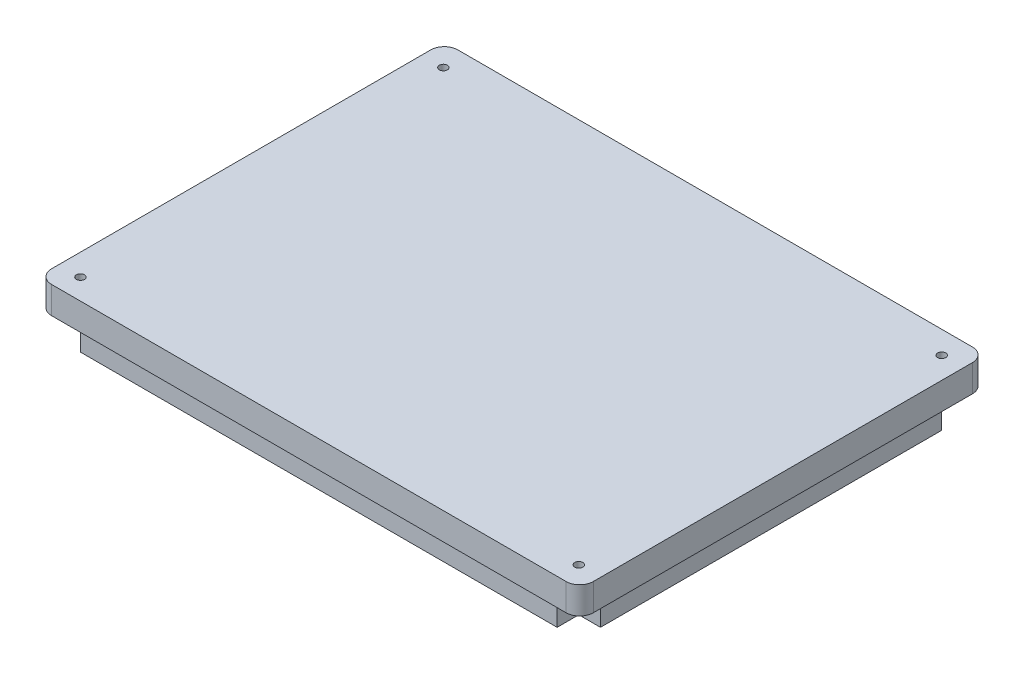
from build123d import *

# Parameters (mm, degrees)
DODANIE_WYCI_GNI_CIE1_DEPTH = 10
DODANIE_WYCI_GNI_CIE2_DEPTH = 10
SZKIC5_R                    = 1.5
WYTNIJ_WYCI_GNI_CIE1_DEPTH  = 15


with BuildPart() as part:
    # Szkic1 → Dodanie-wyciągnięcie1 (new body)
    with BuildSketch(Plane(origin=(0, 0, 0), x_dir=(1, 0, 0), z_dir=(0, 1, 0))):
        with BuildLine():
            Line((-94.981523654, 75.273037309), (95.018476346, 75.273037309))
            ThreePointArc((95.018476346, 75.273037309), (98.554010252, 73.808571215), (100.018476346, 70.273037309))
            Line((100.018476346, 70.273037309), (100.018476346, -69.726962691))
            ThreePointArc((100.018476346, -69.726962691), (98.554010252, -73.262496597), (95.018476346, -74.726962691))
            Line((95.018476346, -74.726962691), (-94.981523654, -74.726962691))
            ThreePointArc((-94.981523654, -74.726962691), (-98.51705756, -73.262496597), (-99.981523654, -69.726962691))
            Line((-99.981523654, -69.726962691), (-99.981523654, 70.273037309))
            ThreePointArc((-99.981523654, 70.273037309), (-98.51705756, 73.808571215), (-94.981523654, 75.273037309))
        make_face()
    extrude(amount=DODANIE_WYCI_GNI_CIE1_DEPTH)

    # Szkic4 → Dodanie-wyciągnięcie2 (add)
    with BuildSketch(Plane.XZ):
        Polygon((-96, 63.04375976), (-88, 63.04375976), (-88, 71.04375976), (88, 71.04375976), (88, 63.04375976), (96, 63.04375976), (96, -62.95624024), (88, -62.95624024), (88, -70.95624024), (-88, -70.95624024), (-88, -62.95624024), (-96, -62.95624024), align=None)
    extrude(amount=DODANIE_WYCI_GNI_CIE2_DEPTH)

    # Szkic5 → Wytnij-wyciągnięcie1 (cut)
    with BuildSketch(Plane.XZ):
        with Locations(Location((-92, -66.95624024, 0), (0, 0, 270))):
            Circle(SZKIC5_R)
        with Locations(Location((-92, 67.04375976, 0), (0, 0, 270))):
            Circle(SZKIC5_R)
        with Locations(Location((92, 67.04375976, 0), (0, 0, 270))):
            Circle(SZKIC5_R)
        with Locations(Location((92, -66.95624024, 0), (0, 0, 270))):
            Circle(SZKIC5_R)
    extrude(amount=-WYTNIJ_WYCI_GNI_CIE1_DEPTH, mode=Mode.SUBTRACT)


solid = part.part
